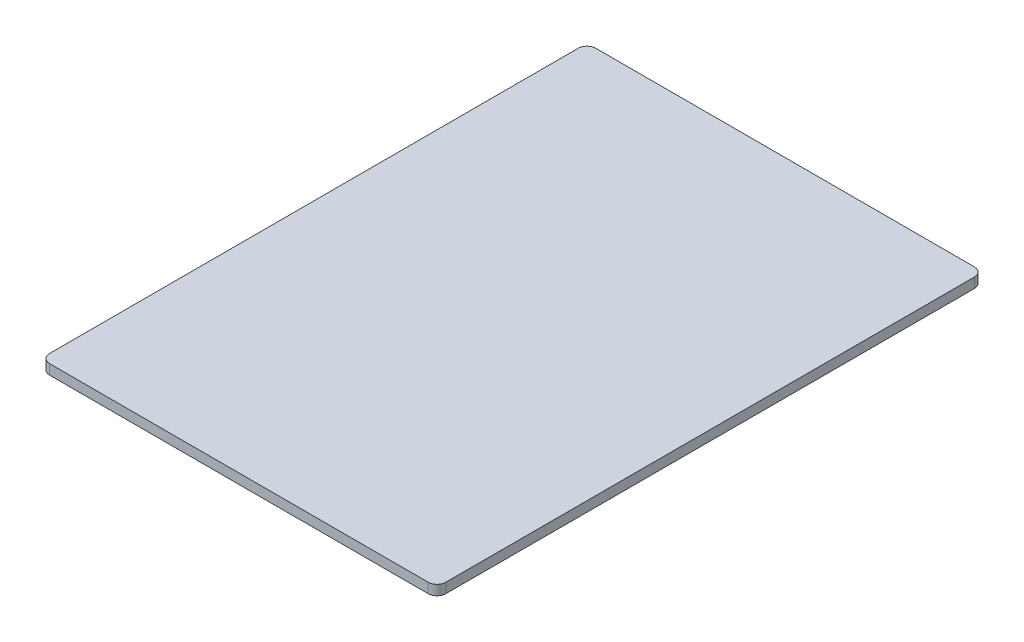
from build123d import *

# Parameters (mm, degrees)
SKETCH_1_W      = 44.72
SKETCH_1_H      = 61.65
EXTRUDE_1_DEPTH = 1.125
FILLET_1_R      = 1
SKETCH_2_W      = 37.22
SKETCH_2_H      = 49.65
EXTRUDE_2_DEPTH = 0.78


with BuildPart() as part:
    # 草图1 → 凸台-拉伸1 (new body)
    with BuildSketch(Plane(origin=(0, 0, 0), x_dir=(1, 0, 0), z_dir=(0, 1, 0))):
        with Locations((-1.696923077, -14.271057692)):
            Rectangle(SKETCH_1_W, SKETCH_1_H)
    extrude(amount=EXTRUDE_1_DEPTH)

    # 圆角1
    fillet_1_edges = [part.edges().sort_by_distance(p)[0] for p in [
        (-24.056923077, 0.5625, -16.553942308),
        (20.663076923, 0.5625, -16.553942308),
        (20.663076923, 0.5625, 45.096057692),
        (-24.056923077, 0.5625, 45.096057692),
    ]]
    fillet(fillet_1_edges, radius=FILLET_1_R)

    # 草图2 → 凸台-拉伸2 (add)
    with BuildSketch(Plane.XZ):
        with Locations((-1.696923077, 14.731057692)):
            Rectangle(SKETCH_2_W, SKETCH_2_H)
    extrude(amount=EXTRUDE_2_DEPTH)


solid = part.part
